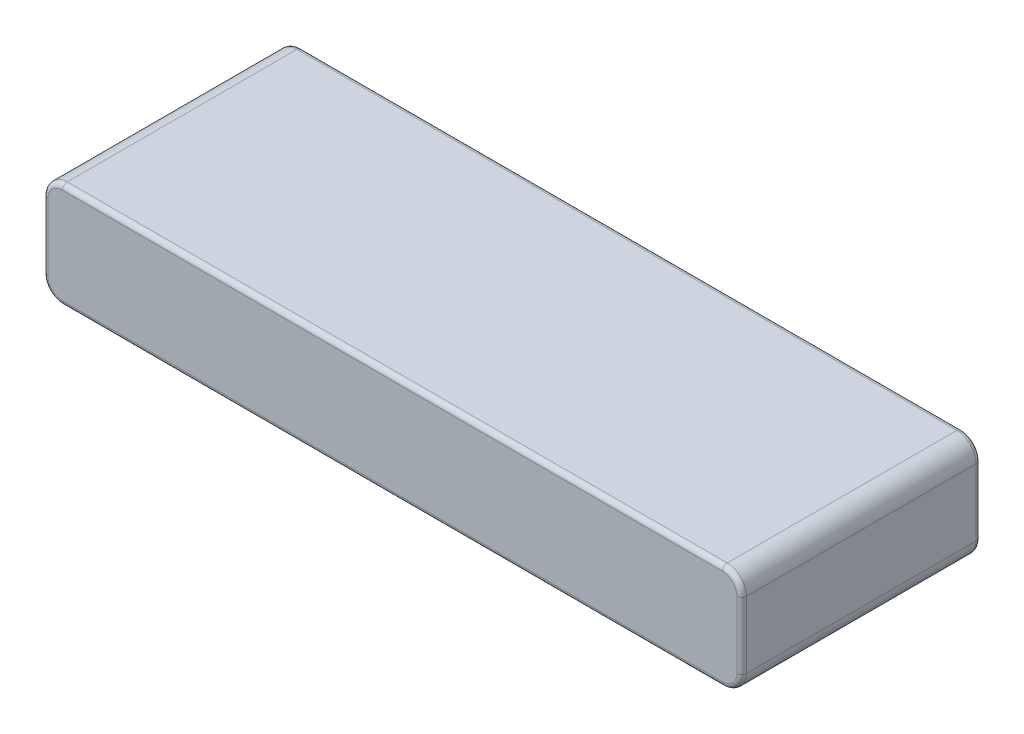
from build123d import *

# Parameters (mm, degrees)
SKETCH1_W           = 144.9578
SKETCH1_H           = 49.6316
BOSS_EXTRUDE1_DEPTH = 21.8694
FILLET1_R           = 4
FILLET2_R           = 1


with BuildPart() as part:
    # Sketch1 → Boss-Extrude1 (new body)
    with BuildSketch(Plane(origin=(0, 0, 0), x_dir=(1, 0, 0), z_dir=(0, 1, 0))):
        Rectangle(SKETCH1_W, SKETCH1_H)
    extrude(amount=BOSS_EXTRUDE1_DEPTH)

    # Fillet1
    fillet1_edges = [part.edges().sort_by_distance(p)[0] for p in [
        (-72.4789, 21.8694, 0),
        (72.4789, 21.8694, 0),
        (-72.4789, 0, 0),
        (72.4789, 0, 0),
    ]]
    fillet(fillet1_edges, radius=FILLET1_R)

    # Fillet2
    fillet2_edges = [part.edges().sort_by_distance(p)[0] for p in [
        (72.4789, 10.9347, -24.8158),
        (72.4789, 10.9347, 24.8158),
        (0, 0, -24.8158),
        (-72.4789, 10.9347, -24.8158),
        (0, 21.8694, -24.8158),
        (-71.307327125, 20.697827125, -24.8158),
        (-71.307327125, 1.171572875, -24.8158),
        (71.307327125, 20.697827125, -24.8158),
        (71.307327125, 1.171572875, -24.8158),
        (0, 0, 24.8158),
        (0, 21.8694, 24.8158),
        (-72.4789, 10.9347, 24.8158),
        (-71.307327125, 20.697827125, 24.8158),
        (-71.307327125, 1.171572875, 24.8158),
        (71.307327125, 20.697827125, 24.8158),
        (71.307327125, 1.171572875, 24.8158),
    ]]
    fillet(fillet2_edges, radius=FILLET2_R)


solid = part.part
